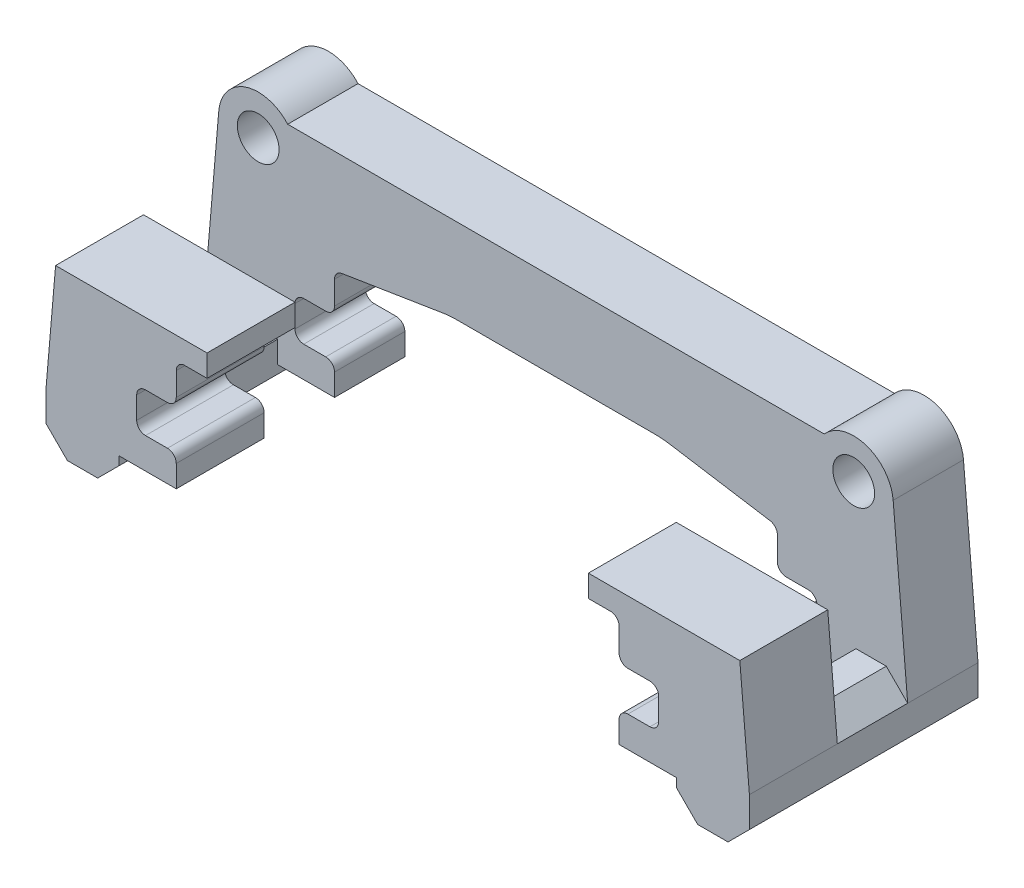
from build123d import *

# Parameters (mm, degrees)
SKETCH1_R           = 5.115
SKETCH1_R_2         = 4.75
BOSS_EXTRUDE1_DEPTH = 16
CUT_EXTRUDE1_DEPTH  = 96.686989711
SKETCH3_R           = 5.115
BOSS_EXTRUDE2_DEPTH = 16
BOSS_EXTRUDE3_DEPTH = 20


with BuildPart() as part:
    # Sketch1 → Boss-Extrude1 (new body)
    with BuildSketch(Plane.XY):
        with BuildLine():
            Line((-80, 3.444150891), (-76.699065455, 41.772249209))
            ThreePointArc((-76.699065455, 41.772249209), (-70.579654753, 49.5377007), (-61.024054334, 47))
            Line((-61.024054334, 47), (61.024054334, 47))
            ThreePointArc((61.024054334, 47), (70.579654753, 49.5377007), (76.699065455, 41.772249209))
            Line((76.699065455, 41.772249209), (80, 3.444150891))
            Line((80, 3.444150891), (80, -3.444150891))
            Line((80, -3.444150891), (75.129235099, -8.314915793))
            Line((75.129235099, -8.314915793), (68.240933316, -8.314915793))
            Line((68.240933316, -8.314915793), (63.370168415, -3.444150891))
            Line((63.370168415, -3.444150891), (63.370168415, -1.5))
            Line((63.370168415, -1.5), (-63.370168415, -1.5))
            Line((-63.370168415, -1.5), (-63.370168415, -3.444150891))
            Line((-63.370168415, -3.444150891), (-68.240933316, -8.314915793))
            Line((-68.240933316, -8.314915793), (-75.129235099, -8.314915793))
            Line((-75.129235099, -8.314915793), (-80, -3.444150891))
            Line((-80, -3.444150891), (-80, 3.444150891))
        make_face()
        with Locations((-71.685084207, 0)):
            Circle(SKETCH1_R, mode=Mode.SUBTRACT)
        with Locations((-67.732258267, 41)):
            Circle(SKETCH1_R_2, mode=Mode.SUBTRACT)
        with Locations(Location((67.732258267, 41, 0), (0, 0, 180))):
            Circle(SKETCH1_R_2, mode=Mode.SUBTRACT)
        with Locations(Location((71.685084207, 0, 0), (0, 0, 180))):
            Circle(SKETCH1_R, mode=Mode.SUBTRACT)
    extrude(amount=BOSS_EXTRUDE1_DEPTH)

    # Sketch2 → Cut-Extrude1 (cut, through all)
    with BuildSketch(Plane(origin=(0, 0, 0), x_dir=(-1, 0, 0), z_dir=(0, 0, -1))):
        with BuildLine():
            Line((-50.370168415, 3.5), (-50.370168415, -2.5))
            Line((-50.370168415, -2.5), (50.370168415, -2.5))
            Line((50.370168415, -2.5), (50.370168415, 3.5))
            ThreePointArc((50.370168415, 3.5), (50.955954852, 4.914213562), (52.370168415, 5.5))
            Line((52.370168415, 5.5), (57.370168415, 5.5))
            ThreePointArc((57.370168415, 5.5), (58.784381977, 6.085786438), (59.370168415, 7.5))
            Line((59.370168415, 7.5), (59.370168415, 12.5))
            ThreePointArc((59.370168415, 12.5), (58.784381977, 13.914213562), (57.370168415, 14.5))
            Line((57.370168415, 14.5), (52.370168415, 14.5))
            ThreePointArc((52.370168415, 14.5), (50.955954852, 15.085786438), (50.370168415, 16.5))
            Line((50.370168415, 16.5), (50.370168415, 21.795575149))
            ThreePointArc((50.370168415, 21.795575149), (49.892383898, 23.092826098), (48.687308391, 23.770270629))
            Line((48.687308391, 23.770270629), (25.72087261, 27.45872537))
            ThreePointArc((25.72087261, 27.45872537), (24.140212323, 27.648408909), (22.549472845, 27.711770579))
            Line((22.549472845, 27.711770579), (-22.549472845, 27.711770579))
            ThreePointArc((-22.549472845, 27.711770579), (-24.140212323, 27.648408909), (-25.72087261, 27.45872537))
            Line((-25.72087261, 27.45872537), (-48.687308391, 23.770270629))
            ThreePointArc((-48.687308391, 23.770270629), (-49.892383898, 23.092826098), (-50.370168415, 21.795575149))
            Line((-50.370168415, 21.795575149), (-50.370168415, 16.5))
            ThreePointArc((-50.370168415, 16.5), (-50.955954852, 15.085786438), (-52.370168415, 14.5))
            Line((-52.370168415, 14.5), (-57.370168415, 14.5))
            ThreePointArc((-57.370168415, 14.5), (-58.784381977, 13.914213562), (-59.370168415, 12.5))
            Line((-59.370168415, 12.5), (-59.370168415, 7.5))
            ThreePointArc((-59.370168415, 7.5), (-58.784381977, 6.085786438), (-57.370168415, 5.5))
            Line((-57.370168415, 5.5), (-52.370168415, 5.5))
            ThreePointArc((-52.370168415, 5.5), (-50.955954852, 4.914213562), (-50.370168415, 3.5))
        make_face()
    extrude(amount=-CUT_EXTRUDE1_DEPTH, mode=Mode.SUBTRACT)

    # Sketch3 → Boss-Extrude2 (add)
    with BuildSketch(Plane.XY.offset(16)):
        Polygon((-80, 3.444150891), (-80, -3.444150891), (-75.129235099, -8.314915793), (-68.240933316, -8.314915793), (-63.370168415, -3.444150891), (-63.370168415, 3.444150891), (-68.240933316, 8.314915793), (-75.129235099, 8.314915793), align=None)
        with Locations((-71.685084207, 0)):
            Circle(SKETCH3_R, mode=Mode.SUBTRACT)
    boss_extrude2 = extrude(amount=BOSS_EXTRUDE2_DEPTH)

    # Mirror1: Boss-Extrude2 across plane
    add(boss_extrude2.mirror(Plane(origin=(0, 0, 0), x_dir=(0, 0, 1), z_dir=(1, 0, 0))))

    # Sketch4 → Boss-Extrude3 (add)
    with BuildSketch(Plane.XY.offset(32)):
        with BuildLine():
            Line((-77.818836123, 28.770270629), (-43.370168415, 28.770270629))
            Line((-43.370168415, 28.770270629), (-43.370168415, 23.770270629))
            Line((-43.370168415, 23.770270629), (-48.687308391, 23.770270629))
            ThreePointArc((-48.687308391, 23.770270629), (-49.892383898, 23.092826098), (-50.370168415, 21.795575149))
            Line((-50.370168415, 21.795575149), (-50.370168415, 16.5))
            ThreePointArc((-50.370168415, 16.5), (-50.955954852, 15.085786438), (-52.370168415, 14.5))
            Line((-52.370168415, 14.5), (-57.370168415, 14.5))
            ThreePointArc((-57.370168415, 14.5), (-58.784381977, 13.914213562), (-59.370168415, 12.5))
            Line((-59.370168415, 12.5), (-59.370168415, 7.5))
            ThreePointArc((-59.370168415, 7.5), (-58.784381977, 6.085786438), (-57.370168415, 5.5))
            Line((-57.370168415, 5.5), (-52.370168415, 5.5))
            ThreePointArc((-52.370168415, 5.5), (-50.955954852, 4.914213562), (-50.370168415, 3.5))
            Line((-50.370168415, 3.5), (-50.370168415, -1.5))
            Line((-50.370168415, -1.5), (-63.370168415, -1.5))
            Line((-63.370168415, -1.5), (-63.370168415, -3.444150891))
            Line((-63.370168415, -3.444150891), (-68.240933316, -8.314915793))
            Line((-68.240933316, -8.314915793), (-75.129235099, -8.314915793))
            Line((-75.129235099, -8.314915793), (-80, -3.444150891))
            Line((-80, -3.444150891), (-80, 3.444150891))
            Line((-80, 3.444150891), (-77.818836123, 28.770270629))
        make_face()
    boss_extrude3 = extrude(amount=BOSS_EXTRUDE3_DEPTH)

    # Mirror2: Boss-Extrude3 across plane
    add(boss_extrude3.mirror(Plane(origin=(0, 0, 0), x_dir=(0, 0, 1), z_dir=(1, 0, 0))))


solid = part.part
